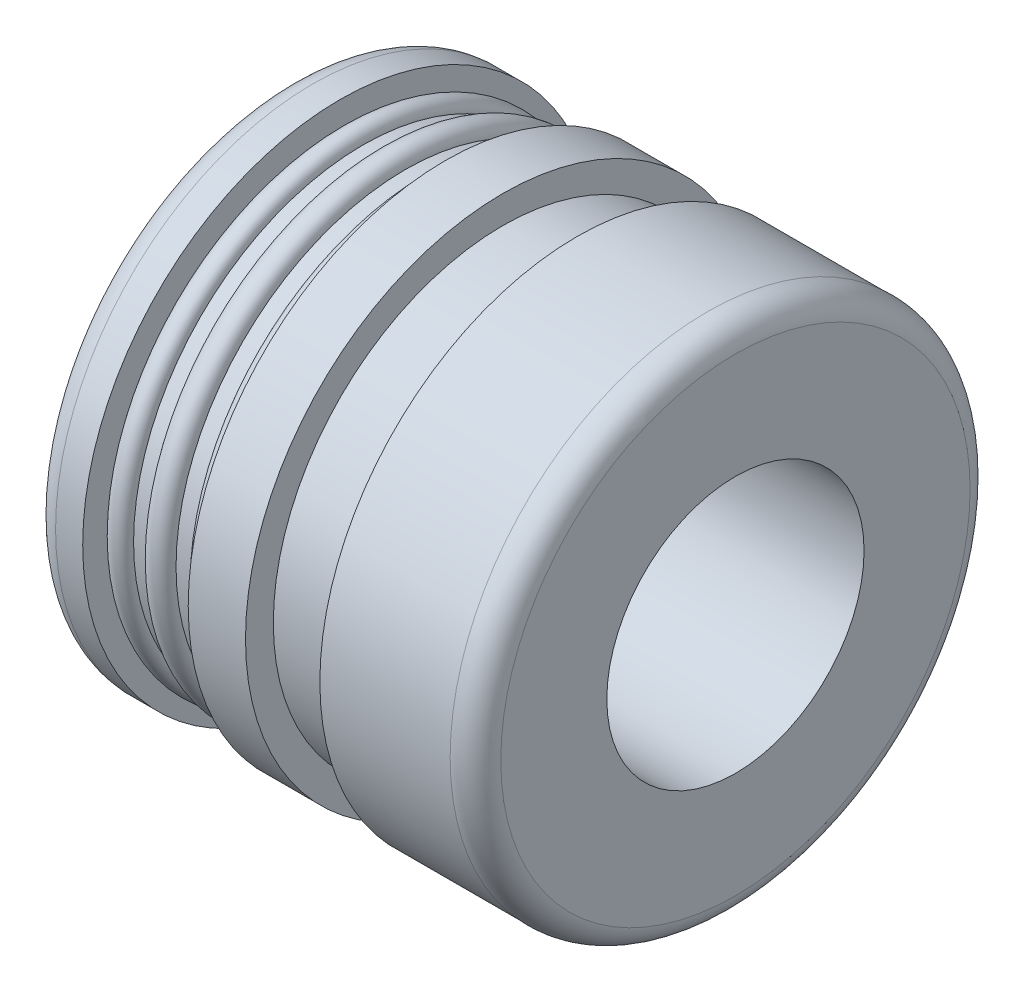
from build123d import *


with BuildPart() as part:
    # Sketch1 → Revolve1 (revolve)
    with BuildSketch(Plane.XY, mode=Mode.PRIVATE) as revolve1_sk:
        with BuildLine():
            Line((3.968787666, 12.7), (3.968787666, 11.32661101))
            Line((3.968787666, 11.32661101), (0.297659075, 11.32661101))
            Line((0.297659075, 11.32661101), (0.297659075, 12.7))
            Line((0.297659075, 12.7), (-2.530102137, 12.7))
            Line((-2.530102137, 12.7), (-2.530102137, 11.32661101))
            Line((-2.530102137, 11.32661101), (-2.574075102, 11.32661101))
            ThreePointArc((-2.574075102, 11.32661101), (-3.086168863, 11.838704771), (-3.598262623, 11.32661101))
            Line((-3.598262623, 11.32661101), (-4.504334849, 11.32661101))
            ThreePointArc((-4.504334849, 11.32661101), (-5.134619043, 11.956895205), (-5.764903238, 11.32661101))
            Line((-5.764903238, 11.32661101), (-6.601622574, 11.32661101))
            ThreePointArc((-6.601622574, 11.32661101), (-7.140925132, 11.865913569), (-7.680227691, 11.32661101))
            Line((-7.680227691, 11.32661101), (-7.739135949, 11.32661101))
            Line((-7.739135949, 11.32661101), (-7.739135949, 12.7))
            Line((-7.739135949, 12.7), (-9.078601787, 12.7))
            ThreePointArc((-9.078601787, 12.7), (-9.979939066, 12.268833482), (-10.3124, 11.32661101))
            Line((-10.3124, 11.32661101), (-10.3124, 6.35))
            Line((-10.3124, 6.35), (11.7856, 6.35))
            Line((11.7856, 6.35), (11.7856, 11.583899001))
            ThreePointArc((11.7856, 11.583899001), (11.324468263, 12.428702849), (10.401032355, 12.7))
            Line((10.401032355, 12.7), (3.968787666, 12.7))
        make_face()
    revolve(revolve1_sk.sketch.rotate(Axis((0, 0, 0), (-1, 0, 0)), 90), axis=Axis((0, 0, 0), (-1, 0, 0)))


solid = part.part
